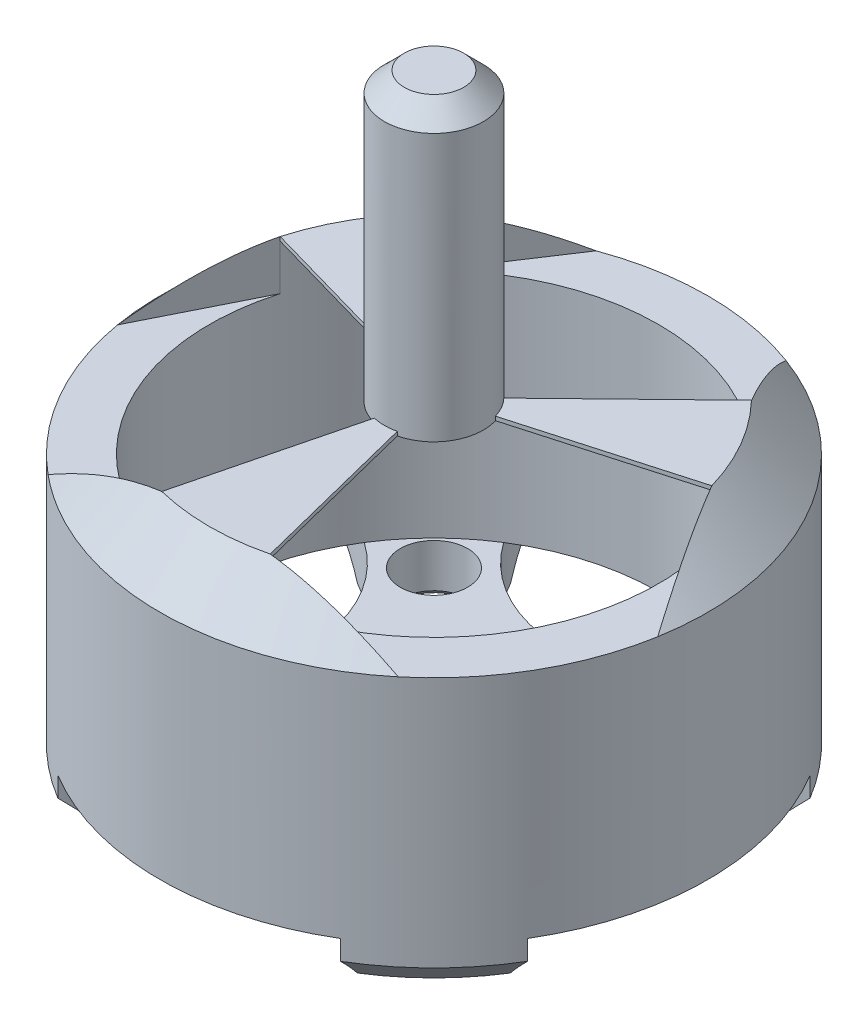
from build123d import *

# Parameters (mm, degrees)
SKETCH2_R                                     = 11.35
CUT_EXTRUDE1_DEPTH                            = 14
SKETCH3_R                                     = 7.414246795
CUT_EXTRUDE2_DEPTH                            = 35.581714822
CIRPATTERN1_COUNT                             = 4
CSK_FOR_M3_COUNTERSUNK_FLAT_HEAD1_D           = 3.4
CSK_FOR_M3_COUNTERSUNK_FLAT_HEAD1_DEPTH       = 2.5
CSK_FOR_M3_COUNTERSUNK_FLAT_HEAD1_CSINK_D     = 4
CSK_FOR_M3_COUNTERSUNK_FLAT_HEAD1_CSINK_ANGLE = 90
CSK_FOR_M3_COUNTERSUNK_FLAT_HEAD3_D           = 3.4
CSK_FOR_M3_COUNTERSUNK_FLAT_HEAD3_DEPTH       = 2.5
CSK_FOR_M3_COUNTERSUNK_FLAT_HEAD3_CSINK_D     = 4
CSK_FOR_M3_COUNTERSUNK_FLAT_HEAD3_CSINK_ANGLE = 90
CUT_EXTRUDE4_DEPTH                            = 2.5
CIRPATTERN2_COUNT                             = 3


with BuildPart() as part:
    # Sketch1 → Revolve1 (revolve)
    with BuildSketch(Plane.XY, mode=Mode.PRIVATE) as revolve1_sk:
        Polygon((0, 0), (-1, 0), (-1, 1), (-12.35, 1), (-13.85, 2.5), (-13.85, 15.2), (-11.35, 17.7), (-2.5, 17.7), (-2.5, 31), (-1.5, 32), (0, 32), align=None)
    revolve(revolve1_sk.sketch.rotate(Axis((0, 41.020495061, 0), (0, -1, 0)), 270), axis=Axis((0, 41.020495061, 0), (0, -1, 0)))

    # Sketch2 → Cut-Extrude1 (cut)
    with BuildSketch(Plane(origin=(0, 3.5, 0), x_dir=(1, 0, 0), z_dir=(0, 1, 0))):
        with Locations(Location((0, 0, 0), (0, 0, 90))):
            Circle(SKETCH2_R)
    extrude(amount=CUT_EXTRUDE1_DEPTH, mode=Mode.SUBTRACT)

    # Sketch3 → Cut-Extrude2 (cut, through all)
    with BuildSketch(Plane(origin=(0, 3.5, 0), x_dir=(1, 0, 0), z_dir=(0, 1, 0))):
        with Locations((0, -13.85)):
            Circle(SKETCH3_R)
    cut_extrude2 = extrude(amount=-CUT_EXTRUDE2_DEPTH, mode=Mode.SUBTRACT)

    # CirPattern1: Cut-Extrude2 ×4 about axis
    cirpattern1_axis = Axis((0, 0, 0), (0, 1, 0))
    for i in range(1, CIRPATTERN1_COUNT):
        add(cut_extrude2.rotate(cirpattern1_axis, i * 360 / CIRPATTERN1_COUNT), mode=Mode.SUBTRACT)

    # CSK for M3 Countersunk Flat Head1
    with Locations(Plane(origin=(0, 1, 0), x_dir=(-1, 0, 0), z_dir=(0, -1, 0))):
        with Locations((5.656854249, -5.656854249), (-5.656854249, 5.656854249)):
            CounterSinkHole(CSK_FOR_M3_COUNTERSUNK_FLAT_HEAD1_D / 2, CSK_FOR_M3_COUNTERSUNK_FLAT_HEAD1_CSINK_D / 2, depth=CSK_FOR_M3_COUNTERSUNK_FLAT_HEAD1_DEPTH, counter_sink_angle=CSK_FOR_M3_COUNTERSUNK_FLAT_HEAD1_CSINK_ANGLE)

    # CSK for M3 Countersunk Flat Head3
    with Locations(Plane(origin=(0, 1, 0), x_dir=(-1, 0, 0), z_dir=(0, -1, 0))):
        with Locations((6.717514421, 6.717514421), (-6.717514421, -6.717514421)):
            CounterSinkHole(CSK_FOR_M3_COUNTERSUNK_FLAT_HEAD3_D / 2, CSK_FOR_M3_COUNTERSUNK_FLAT_HEAD3_CSINK_D / 2, depth=CSK_FOR_M3_COUNTERSUNK_FLAT_HEAD3_DEPTH, counter_sink_angle=CSK_FOR_M3_COUNTERSUNK_FLAT_HEAD3_CSINK_ANGLE)

    # Sketch16 → Cut-Extrude4 (cut)
    with BuildSketch(Plane(origin=(0, 17.7, 0), x_dir=(1, 0, 0), z_dir=(0, 1, 0))):
        with BuildLine():
            Line((-4.79581004, 12.993179213), (-8.169414432, 7.879287267))
            Line((-8.169414432, 7.879287267), (-1.815909947, 1.718275607))
            ThreePointArc((-1.815909947, 1.718275607), (0, 2.5), (1.815909947, 1.718275607))
            Line((1.815909947, 1.718275607), (8.169414432, 7.879287267))
            Line((8.169414432, 7.879287267), (4.79581004, 12.993179213))
            Line((4.79581004, 12.993179213), (0, 16.897060704))
            Line((0, 16.897060704), (-4.79581004, 12.993179213))
        make_face()
    cut_extrude4 = extrude(amount=-CUT_EXTRUDE4_DEPTH, mode=Mode.SUBTRACT)

    # CirPattern2: Cut-Extrude4 ×3 about axis
    cirpattern2_axis = Axis((0, 0, 0), (0, 1, 0))
    for i in range(1, CIRPATTERN2_COUNT):
        add(cut_extrude4.rotate(cirpattern2_axis, i * 360 / CIRPATTERN2_COUNT), mode=Mode.SUBTRACT)


solid = part.part
